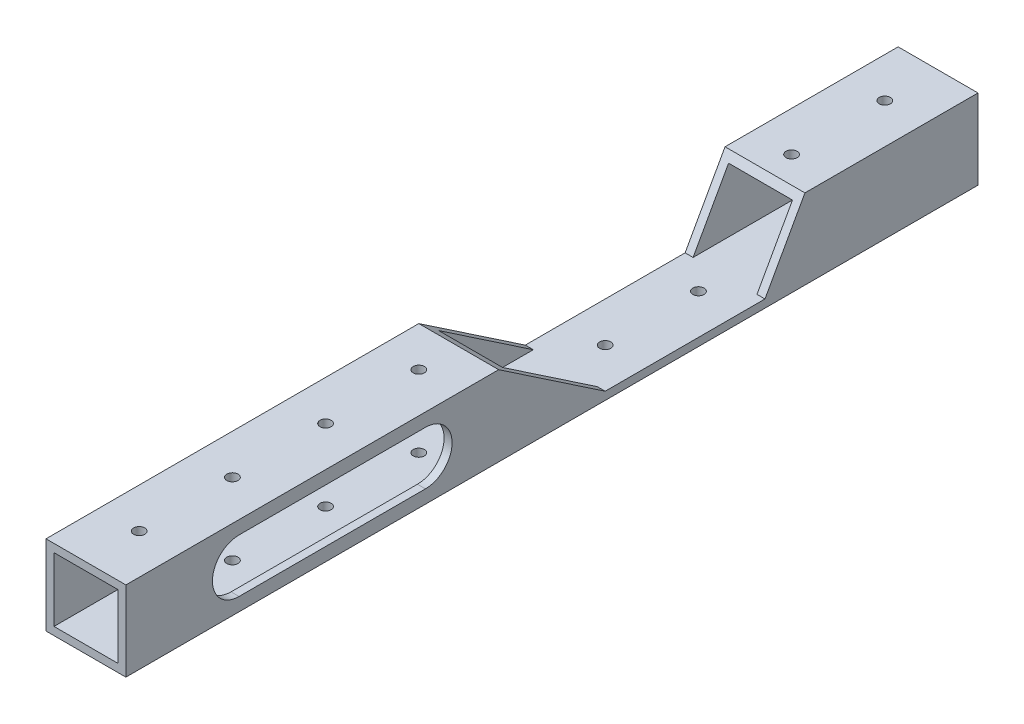
from build123d import *

# Parameters (mm, degrees)
SKETCH_1_W          = 30
SKETCH_1_H          = 30
SKETCH_1_W_2        = 24
SKETCH_1_H_2        = 24
EXTRUDE_1_DEPTH     = 320
CUT_EXTRUDE_1_DEPTH = 323.800247831
SKETCH_3_R          = 2.1
CUT_EXTRUDE_2_DEPTH = 323.800247831
CUT_EXTRUDE_4_DEPTH = 323.800247831


with BuildPart() as part:
    # 草图1 → 拉伸-薄壁1 (new body)
    with BuildSketch(Plane.XY):
        with Locations((15, 15)):
            Rectangle(SKETCH_1_W, SKETCH_1_H)
        with Locations((15, 15)):
            Rectangle(SKETCH_1_W_2, SKETCH_1_H_2, mode=Mode.SUBTRACT)
    extrude(amount=EXTRUDE_1_DEPTH)

    # 草图2 → 切除-拉伸1 (cut, through all)
    with BuildSketch(Plane(origin=(30, 0, 0), x_dir=(0, 0, -1), z_dir=(1, 0, 0))):
        with BuildLine():
            Line((-277.5, 25), (-207.5, 25))
            ThreePointArc((-207.5, 25), (-197.5, 15), (-207.5, 5))
            Line((-207.5, 5), (-277.5, 5))
            ThreePointArc((-277.5, 5), (-287.5, 15), (-277.5, 25))
        make_face()
    extrude(amount=-CUT_EXTRUDE_1_DEPTH, mode=Mode.SUBTRACT)

    # 草图3 → 切除-拉伸2 (cut, through all)
    with BuildSketch(Plane(origin=(0, 30, 0), x_dir=(1, 0, 0), z_dir=(0, 1, 0))):
        with Locations(Location((15, -20, 0), (0, 0, 270))):
            Circle(SKETCH_3_R)
        with Locations(Location((15, -55, 0), (0, 0, 270))):
            Circle(SKETCH_3_R)
        with Locations(Location((15, -90, 0), (0, 0, 270))):
            Circle(SKETCH_3_R)
        with Locations(Location((15, -125, 0), (0, 0, 270))):
            Circle(SKETCH_3_R)
        with Locations(Location((15, -300, 0), (0, 0, 90))):
            Circle(SKETCH_3_R)
        with Locations(Location((15, -265, 0), (0, 0, 90))):
            Circle(SKETCH_3_R)
        with Locations(Location((15, -230, 0), (0, 0, 90))):
            Circle(SKETCH_3_R)
        with Locations(Location((15, -195, 0), (0, 0, 90))):
            Circle(SKETCH_3_R)
        with Locations(Location((15, -160, 0), (0, 0, 270))):
            Circle(SKETCH_3_R)
    extrude(amount=-CUT_EXTRUDE_2_DEPTH, mode=Mode.SUBTRACT)

    # 草图4 → 切除-拉伸4 (cut, through all)
    with BuildSketch(Plane(origin=(0, 0, 0), x_dir=(0, 0, -1), z_dir=(1, 0, 0))):
        Polygon((-180, 30), (-140, 3), (-80, 3), (-65, 30), align=None)
    extrude(amount=CUT_EXTRUDE_4_DEPTH, mode=Mode.SUBTRACT)


solid = part.part
